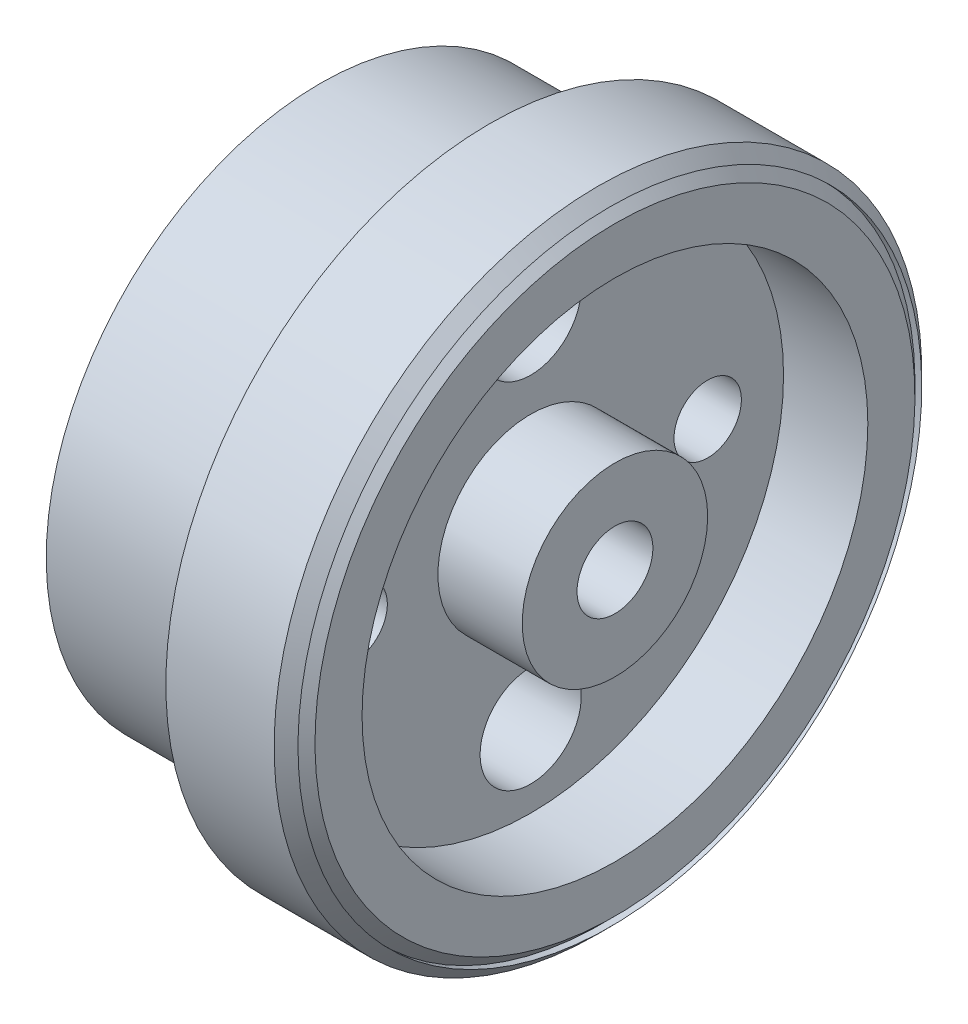
from build123d import *

# Parameters (mm, degrees)
ESQUISSE2_R                  = 30
ESQUISSE2_R_2                = 11
ENL_V_MAT_EXTRU_2_DEPTH      = 10
ESQUISSE4_R                  = 4
ENL_V_MAT_EXTRU_3_DEPTH      = 65.601563534
ESQUISSE5_R                  = 6
ENL_V_MAT_EXTRU_4_DEPTH      = 65.601563534
R_P_TITION_CIRCULAIRE1_COUNT = 2
R_P_TITION_CIRCULAIRE1_ANGLE = 180


with BuildPart() as part:
    # Esquisse1 → Révolution1 (revolve)
    with BuildSketch(Plane.XY, mode=Mode.PRIVATE) as r_volution1_sk:
        Polygon((-0.603091605, -37), (-1.414213562, -37), (0, -35.585786438), (0, -4.5), (-20.414163341, -4.5), (-23.429029468, -7.514866127), (-43.429029468, -7.514866127), (-44.957951939, -8.804205522), (-44.957951939, -11), (-36.957951939, -11), (-36.957951939, -11.014343795), (-34.957951939, -11.014343795), (-34.957951939, -15.337655327), (-34.957951939, -27.510373989), (-34.957951939, -32.507595335), (-15.957951939, -32.507595335), (-15.957951939, -36.740873266), (-14.862537746, -38.414213562), (-2.017305168, -38.414213562), align=None)
    revolve(r_volution1_sk.sketch.rotate(Axis((0, 0, 0), (-1, 0, 0)), 180), axis=Axis((0, 0, 0), (-1, 0, 0)))

    # Esquisse2 → Enlèv. mat.-Extru.2 (cut)
    with BuildSketch(Plane(origin=(0, 0, 0), x_dir=(0, 0, -1), z_dir=(1, 0, 0))):
        Circle(ESQUISSE2_R)
        with Locations(Location((0, 0, 0), (0, 0, 90))):
            Circle(ESQUISSE2_R_2, mode=Mode.SUBTRACT)
    extrude(amount=-ENL_V_MAT_EXTRU_2_DEPTH, mode=Mode.SUBTRACT)

    # Esquisse4 → Enlèv. mat.-Extru.3 (cut, through all)
    with BuildSketch(Plane(origin=(-10, 0, 0), x_dir=(0, 0, -1), z_dir=(1, 0, 0))):
        with Locations((21, 0)):
            Circle(ESQUISSE4_R)
        with Locations(Location((-21, 0, 0), (0, 0, 90))):
            Circle(ESQUISSE4_R)
    extrude(amount=-ENL_V_MAT_EXTRU_3_DEPTH, mode=Mode.SUBTRACT)

    # Esquisse5 → Enlèv. mat.-Extru.4 (cut, through all)
    with BuildSketch(Plane(origin=(-10, 0, 0), x_dir=(0, 0, -1), z_dir=(1, 0, 0))):
        with Locations((0, 21)):
            Circle(ESQUISSE5_R)
    enl_v_mat_extru_4 = extrude(amount=-ENL_V_MAT_EXTRU_4_DEPTH, mode=Mode.SUBTRACT)

    # Répétition circulaire1: Enlèv. mat.-Extru.4 ×2 about axis
    r_p_tition_circulaire1_axis = Axis((0, 0, 0), (1, 0, 0))
    for i in range(1, R_P_TITION_CIRCULAIRE1_COUNT):
        add(enl_v_mat_extru_4.rotate(r_p_tition_circulaire1_axis, i * R_P_TITION_CIRCULAIRE1_ANGLE / (R_P_TITION_CIRCULAIRE1_COUNT - 1)), mode=Mode.SUBTRACT)


solid = part.part
